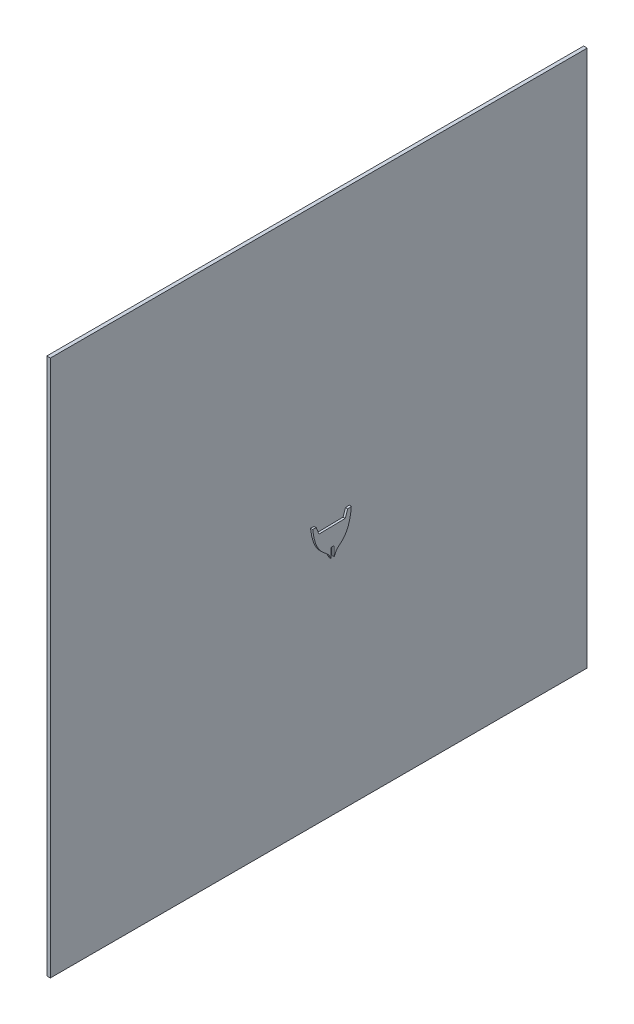
from build123d import *

# Parameters (mm, degrees)
BOSS_EXTRU_2_DEPTH      = 10
BOSS_EXTRU_3_DEPTH      = 6
ENL_V_MAT_EXTRU_1_DEPTH = 6


with BuildPart() as part:
    # Esquisse3D1 → Boss.-Extru.2 (new body)
    with BuildSketch(Plane(origin=(-20, 1121.289346724, 777.274991403), x_dir=(0, -0.7071067811865476, -0.7071067811865476), z_dir=(1, 0, 0))):
        Polygon((0, 0), (1060.66017178, 1060.66017178), (2121.32034356, 0), (1060.66017178, -1060.66017178), align=None)
    extrude(amount=BOSS_EXTRU_2_DEPTH)


with BuildPart() as body_2:
    # Esquisse5 → Boss.-Extru.3 (new body)
    with BuildSketch(Plane(origin=(0, 0, 0), x_dir=(0, 0, -1), z_dir=(1, 0, 0))):
        with BuildLine():
            Line((-42.743657021, 336.070161183), (30.543531084, 337.397786244))
            Line((30.543531084, 337.397786244), (37.397714924, 357.038033491))
            Line((37.397714924, 357.038033491), (47.54183954, 358.062538617))
            add(Edge.make_bspline(
                [(-4.440912922, 245.146035867), (5.270551499, 286.996692264), (14.383631107, 279.496161382), (42.355050039, 288.340732696), (47.54183954, 358.062538617)],
                knots=[0, 0, 0, 0, 0, 1, 1, 1, 1, 1], degree=4))
            add(Edge.make_bspline(
                [(-4.440912922, 245.146035867), (-15.661788901, 286.617495021), (-24.497228506, 278.791819943), (-52.77063524, 286.617495021), (-60.479266526, 356.105695529)],
                knots=[0, 0, 0, 0, 0, 1, 1, 1, 1, 1], degree=4))
            Line((-60.479266526, 356.105695529), (-50.304691241, 355.449271317))
            Line((-50.304691241, 355.449271317), (-42.743657021, 336.070161183))
        make_face()
    extrude(amount=BOSS_EXTRU_3_DEPTH)

    # Esquisse6 → Enlèv. mat.-Extru.1 (cut)
    with BuildSketch(Plane(origin=(6, 0, 0), x_dir=(0, 0, -1), z_dir=(1, 0, 0))):
        Polygon((-9.209725321, 259.903423689), (-9.698840507, 286.903423689), (-0.698840507, 287.066462084), (-0.209725321, 260.066462084), (117.063261114, -47.52702125), (-85.227699586, -65.220017949), align=None)
    extrude(amount=-ENL_V_MAT_EXTRU_1_DEPTH, mode=Mode.SUBTRACT)


solid = Compound([part.part, body_2.part])
